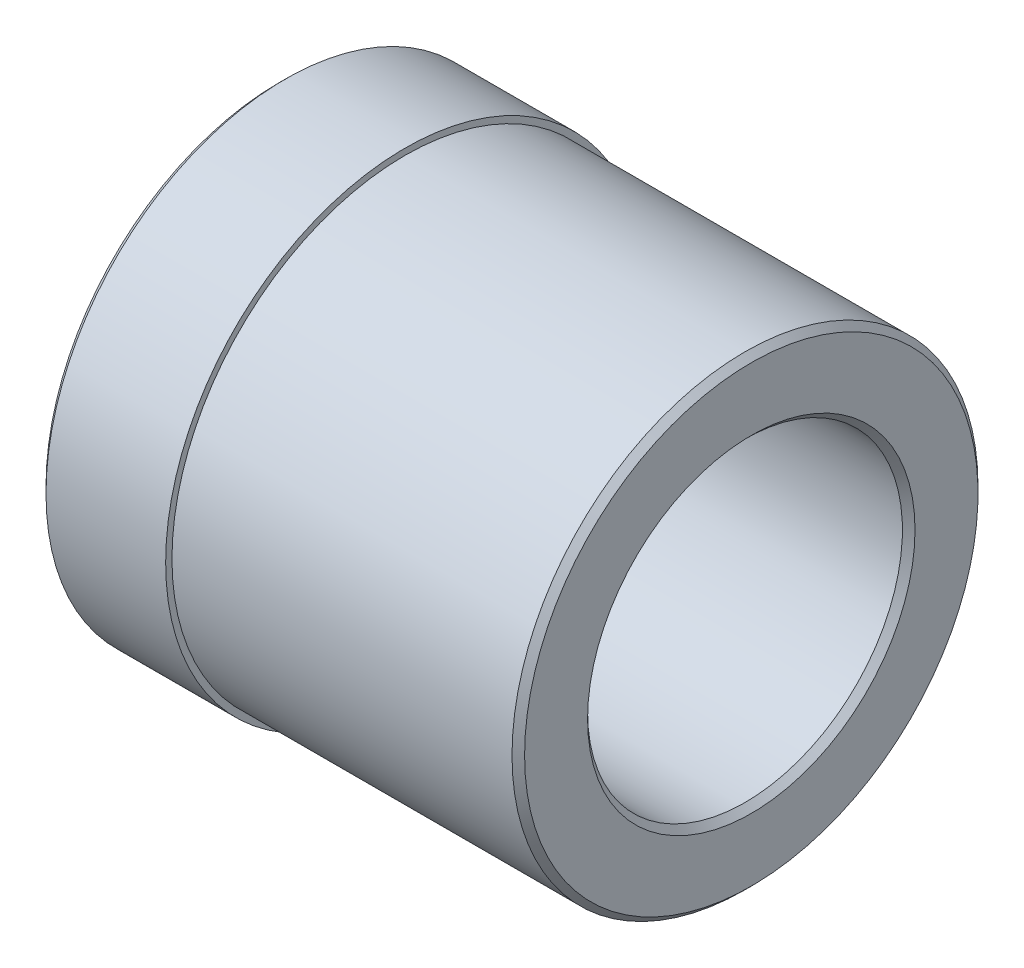
from build123d import *

# Parameters (mm, degrees)
CHAMFER_1_SIZE = 1


with BuildPart() as part:
    # 草图1 → 旋转1 (revolve)
    with BuildSketch(Plane.XY, mode=Mode.PRIVATE) as revolve_1_sk:
        Polygon((0, 25), (0, 38), (20, 38), (20, 37), (75, 37), (75, 25), align=None)
    revolve(revolve_1_sk.sketch.rotate(Axis((0, 0, 0), (1, 0, 0)), 90), axis=Axis((0, 0, 0), (1, 0, 0)))

    # 倒角1
    chamfer_1_edges = [part.edges().sort_by_distance(p)[0] for p in [
        (75, 0, -25),
        (75, 0, -37),
        (0, 0, -38),
        (0, 0, -25),
    ]]
    chamfer(chamfer_1_edges, length=CHAMFER_1_SIZE)


solid = part.part
